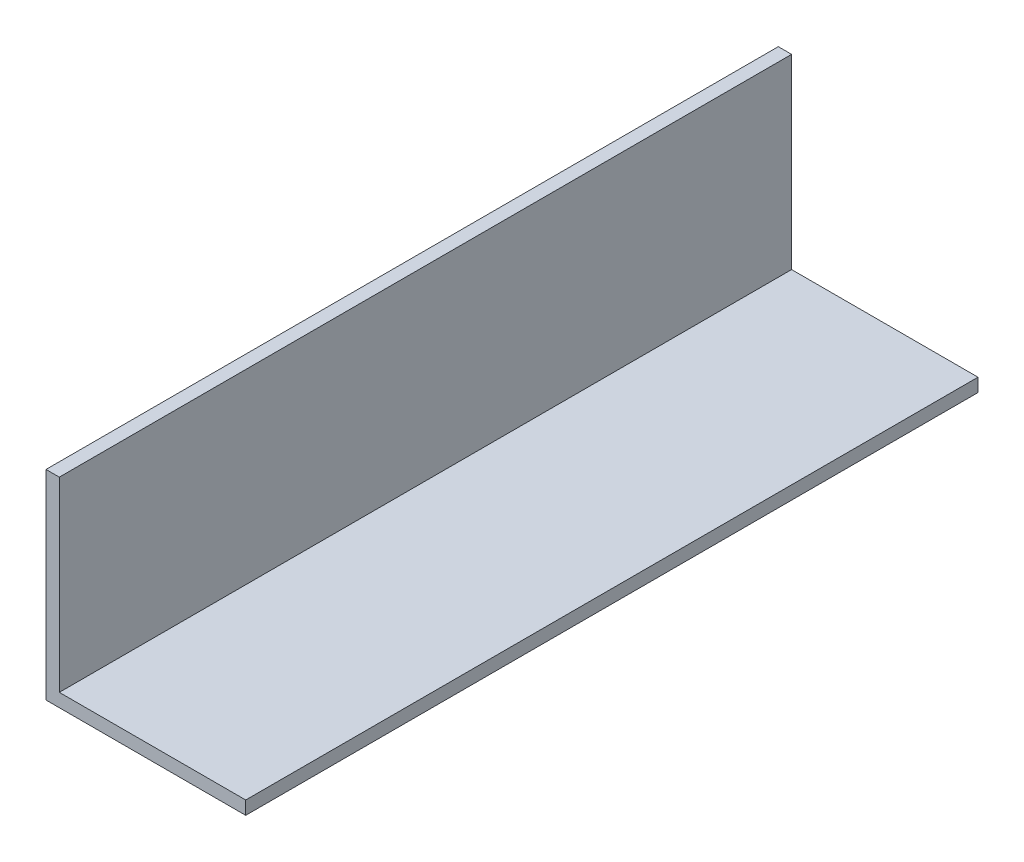
from build123d import *

# Parameters (mm, degrees)
BOSS_EXTRU_1_DEPTH = 110


with BuildPart() as part:
    # Esquisse1 → Boss.-Extru.1 (new body)
    with BuildSketch(Plane.XY):
        Polygon((0, 0), (0, 30), (2, 30), (2, 2), (30, 2), (30, 0), align=None)
    extrude(amount=BOSS_EXTRU_1_DEPTH)


solid = part.part
